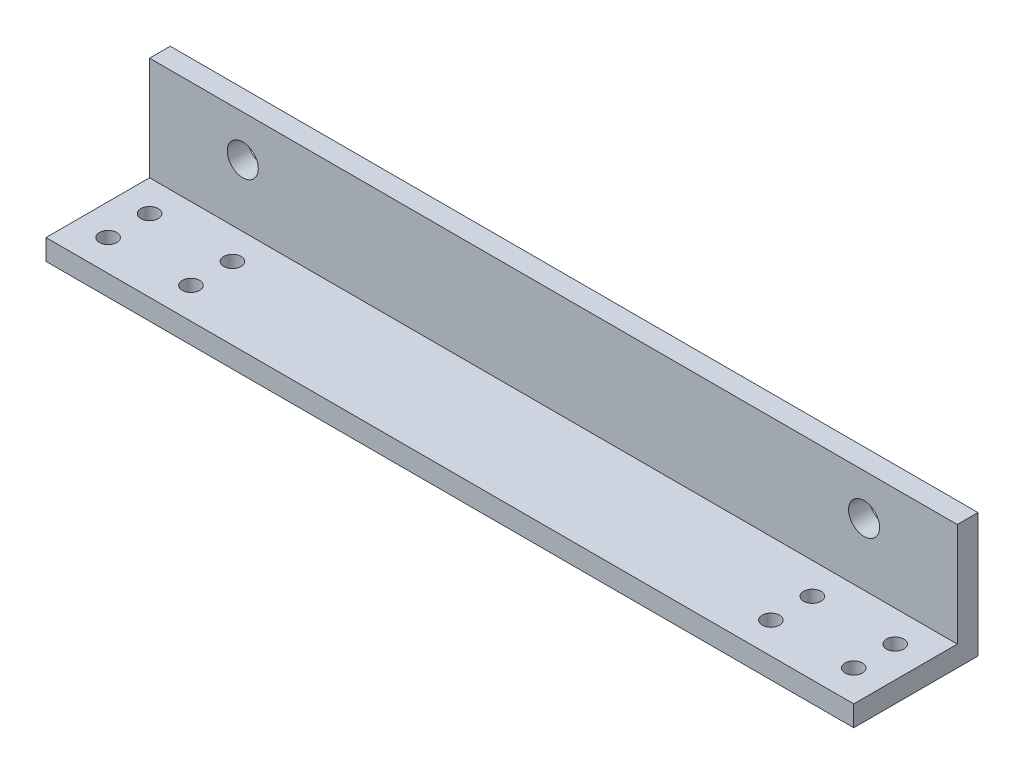
from build123d import *

# Parameters (mm, degrees)
EXTRUDE_THIN1_DEPTH          = 123.825
F_10_CLEARANCE_HOLE1_D       = 5.334
F_3_8_0_375_DIAMETER_HOLE1_D = 9.525


with BuildPart() as part:
    # Sketch1 → Extrude-Thin1 (new, symmetric)
    with BuildSketch(Plane(origin=(0, 0, 0), x_dir=(0, 0, -1), z_dir=(1, 0, 0))):
        Polygon((-38.1, 0), (0, 0), (0, 38.1), (-6.35, 38.1), (-6.35, 6.35), (-38.1, 6.35), align=None)
    extrude(amount=EXTRUDE_THIN1_DEPTH, both=True)

    # #10 Clearance Hole1 (through all)
    with Locations(Plane(origin=(0, 6.35, 0), x_dir=(1, 0, 0), z_dir=(0, 1, 0))):
        with Locations((-114.3, -15.875), (-114.3, -28.575), (-88.9, -28.575), (-88.9, -15.875), (88.9, -15.875), (88.9, -28.575), (114.3, -28.575), (114.3, -15.875)):
            Hole(F_10_CLEARANCE_HOLE1_D / 2)

    # 3/8 (0.375) Diameter Hole1 (through all)
    with Locations(Plane.XY.offset(6.35)):
        with Locations((-95.25, 25.4), (95.25, 25.4)):
            Hole(F_3_8_0_375_DIAMETER_HOLE1_D / 2)


solid = part.part
